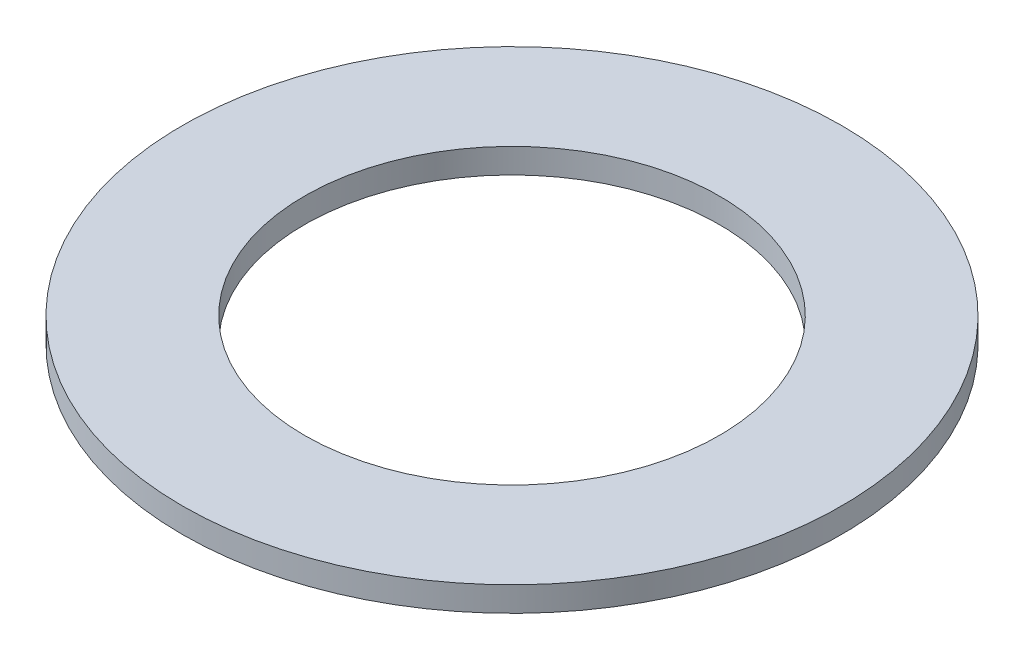
from build123d import *

# Parameters (mm, degrees)
SKETCH1_R           = 5.72
SKETCH1_R_2         = 3.6
BOSS_EXTRUDE1_DEPTH = 0.43


with BuildPart() as part:
    # Sketch1 → Boss-Extrude1 (new body)
    with BuildSketch(Plane(origin=(0, 0, 0), x_dir=(1, 0, 0), z_dir=(0, 1, 0))):
        with Locations(Location((0, 0, 0), (0, 0, 270))):
            Circle(SKETCH1_R)
        with Locations(Location((0, 0, 0), (0, 0, 270))):
            Circle(SKETCH1_R_2, mode=Mode.SUBTRACT)
    extrude(amount=BOSS_EXTRUDE1_DEPTH)


solid = part.part
